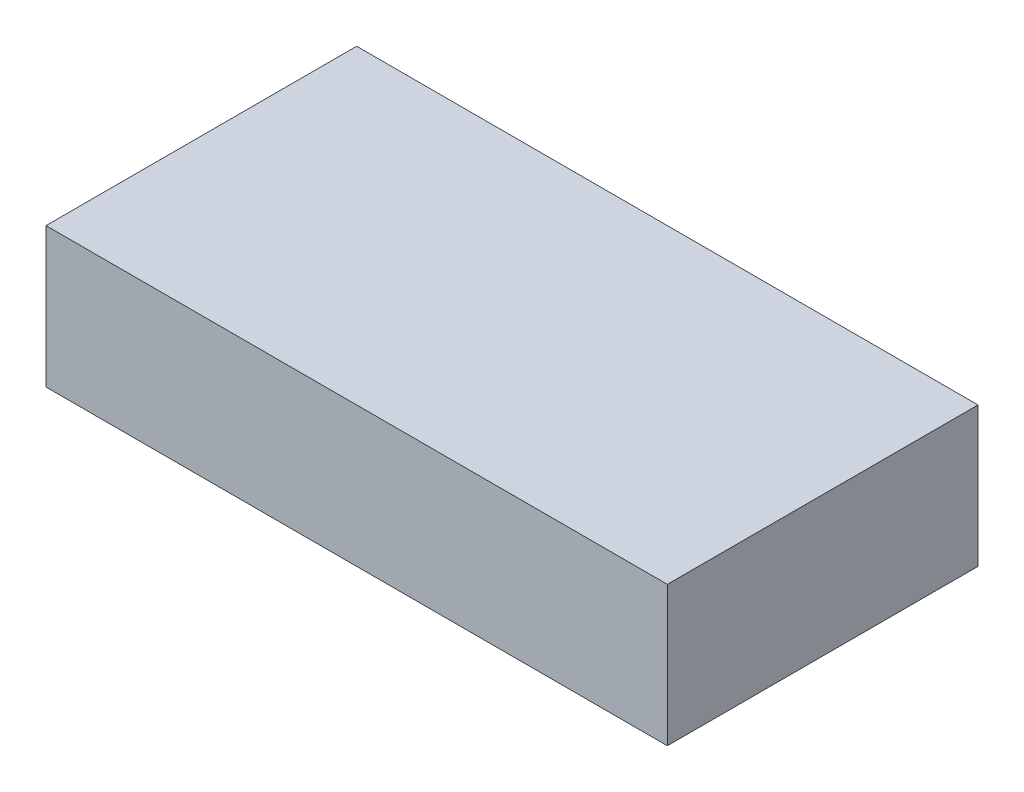
from build123d import *

# Parameters (mm, degrees)
ESQUISSE1_W        = 200
ESQUISSE1_H        = 100
BOSS_EXTRU_1_DEPTH = 45


with BuildPart() as part:
    # Esquisse1 → Boss.-Extru.1 (new body)
    with BuildSketch(Plane(origin=(0, 0, 0), x_dir=(1, 0, 0), z_dir=(0, 1, 0))):
        Rectangle(ESQUISSE1_W, ESQUISSE1_H)
    extrude(amount=BOSS_EXTRU_1_DEPTH)


solid = part.part
